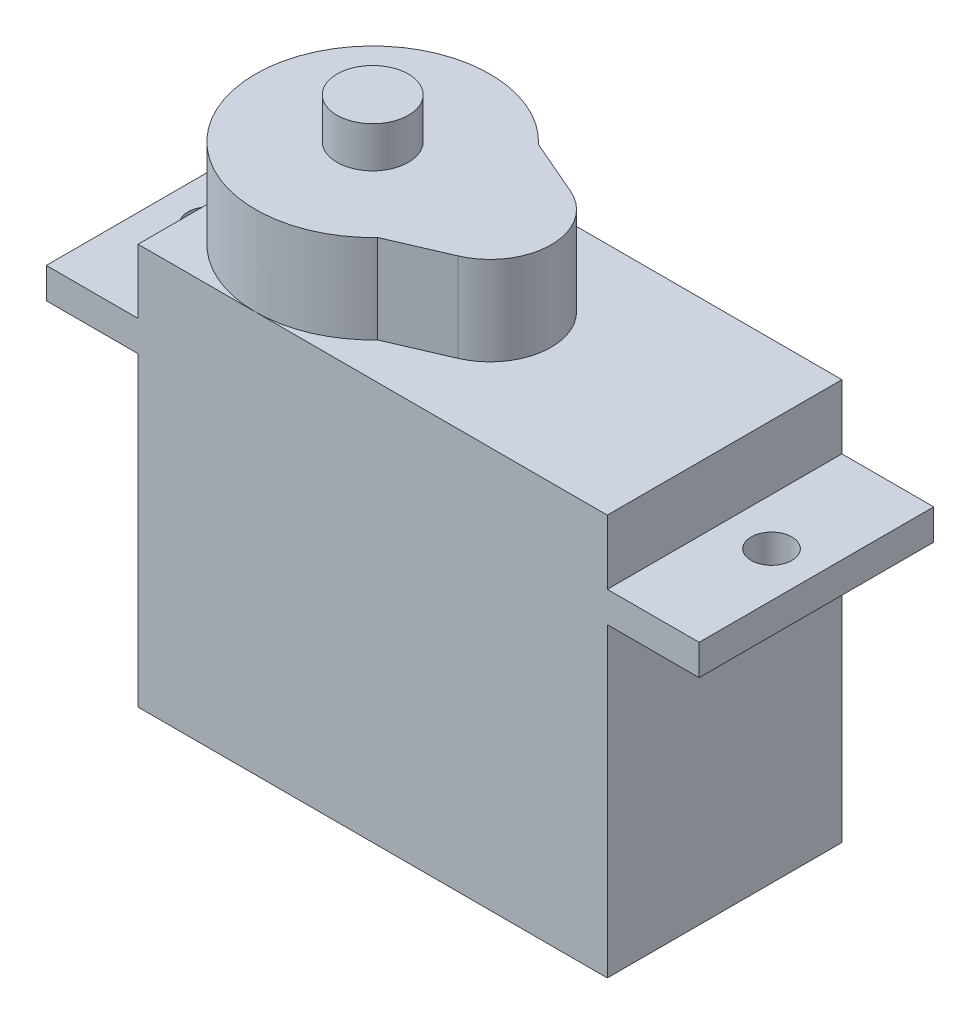
from build123d import *

# Parameters (mm, degrees)
SKETCH_1_W          = 23
SKETCH_1_H          = 11.5
EXTRUDE_1_DEPTH     = 15
EXTRUDE_START       = 15
SKETCH_2_W          = 32
SKETCH_2_H          = 11.5
EXTRUDE_2_DEPTH     = 1.5
SKETCH_3_W          = 23
SKETCH_3_H          = 11.5
EXTRUDE_3_DEPTH     = 19.65
SKETCH_4_R          = 1
CUT_EXTRUDE_1_DEPTH = 19.65
SKETCH_5_R          = 5.75
EXTRUDE_4_DEPTH     = 24
EXTRUDE_5_DEPTH     = 24
EXTRUDE_START_2     = 24
SKETCH_7_R          = 1.75
EXTRUDE_6_DEPTH     = 2


with BuildPart() as part:
    # 草图1 → 凸台-拉伸1 (new body)
    with BuildSketch(Plane(origin=(0, 0, 0), x_dir=(1, 0, 0), z_dir=(0, 1, 0))):
        Rectangle(SKETCH_1_W, SKETCH_1_H)
    extrude(amount=EXTRUDE_1_DEPTH)

    # 草图2 → 凸台-拉伸2 (add)
    with BuildSketch(Plane(origin=(0, 0, 0), x_dir=(1, 0, 0), z_dir=(0, 1, 0)).offset(EXTRUDE_START)):
        Rectangle(SKETCH_2_W, SKETCH_2_H)
    extrude(amount=EXTRUDE_2_DEPTH)

    # 草图3 → 凸台-拉伸3 (add)
    with BuildSketch(Plane(origin=(0, 0, 0), x_dir=(1, 0, 0), z_dir=(0, 1, 0))):
        Rectangle(SKETCH_3_W, SKETCH_3_H)
    extrude(amount=EXTRUDE_3_DEPTH)

    # 草图4 → 切除-拉伸1 (cut)
    with BuildSketch(Plane(origin=(0, 0, 0), x_dir=(1, 0, 0), z_dir=(0, 1, 0))):
        with Locations(Location((-13.8, 0, 0), (0, 0, 90))):
            Circle(SKETCH_4_R)
        with Locations(Location((13.8, 0, 0), (0, 0, 90))):
            Circle(SKETCH_4_R)
    extrude(amount=CUT_EXTRUDE_1_DEPTH, mode=Mode.SUBTRACT)

    # 草图5 → 凸台-拉伸4 (add)
    with BuildSketch(Plane(origin=(0, 0, 0), x_dir=(1, 0, 0), z_dir=(0, 1, 0))):
        with Locations(Location((-5.75, 0, 0), (0, 0, 270))):
            Circle(SKETCH_5_R)
    extrude(amount=EXTRUDE_4_DEPTH)

    # 草图6 → 凸台-拉伸5 (add)
    with BuildSketch(Plane(origin=(0, 0, 0), x_dir=(1, 0, 0), z_dir=(0, 1, 0))):
        with BuildLine():
            Line((-1.565217391, 3.943360815), (1.189071712, 2.754289103))
            ThreePointArc((1.189071712, 2.754289103), (3, 0), (1.189071712, -2.754289103))
            Line((1.189071712, -2.754289103), (-1.565217391, -3.943360815))
            ThreePointArc((-1.565217391, -3.943360815), (-11.5, 0), (-1.565217391, 3.943360815))
        make_face()
    extrude(amount=EXTRUDE_5_DEPTH)

    # 草图7 → 凸台-拉伸6 (add)
    with BuildSketch(Plane(origin=(0, 0, 0), x_dir=(1, 0, 0), z_dir=(0, 1, 0)).offset(EXTRUDE_START_2)):
        with Locations(Location((-5.75, 0, 0), (0, 0, 270))):
            Circle(SKETCH_7_R)
    extrude(amount=EXTRUDE_6_DEPTH)


solid = part.part
